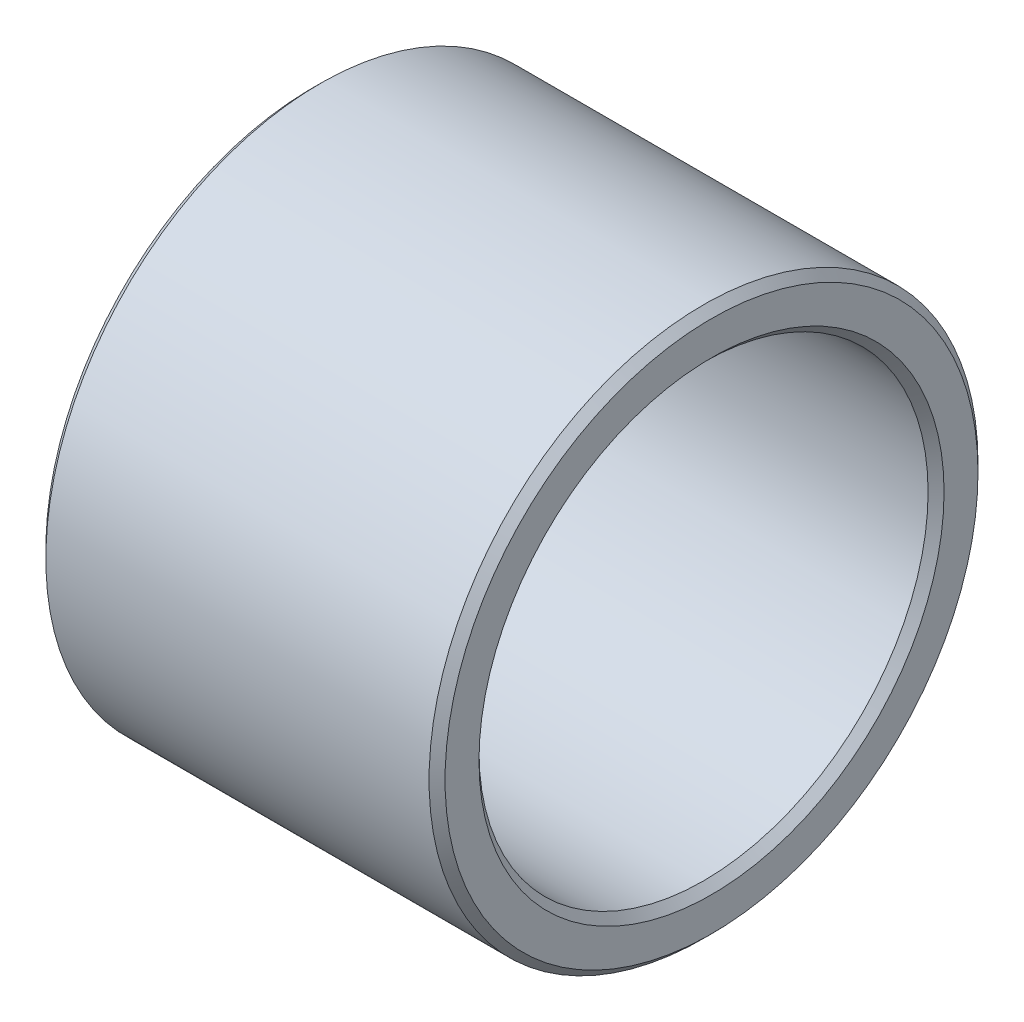
from build123d import *

# Parameters (mm, degrees)
SKETCH1_R           = 17.4625
SKETCH1_R_2         = 14.2875
BOSS_EXTRUDE1_DEPTH = 25.4
CHAMFER1_SIZE       = 0.508


with BuildPart() as part:
    # Sketch1 → Boss-Extrude1 (new body)
    with BuildSketch(Plane(origin=(0, 0, 0), x_dir=(0, 0, -1), z_dir=(1, 0, 0))):
        Circle(SKETCH1_R)
        Circle(SKETCH1_R_2, mode=Mode.SUBTRACT)
    extrude(amount=BOSS_EXTRUDE1_DEPTH)

    # Chamfer1
    chamfer1_edges = [part.edges().sort_by_distance(p)[0] for p in [
        (0, 0, 17.4625),
        (25.4, 0, 17.4625),
        (0, 0, 14.2875),
        (25.4, 0, 14.2875),
    ]]
    chamfer(chamfer1_edges, length=CHAMFER1_SIZE)


solid = part.part
